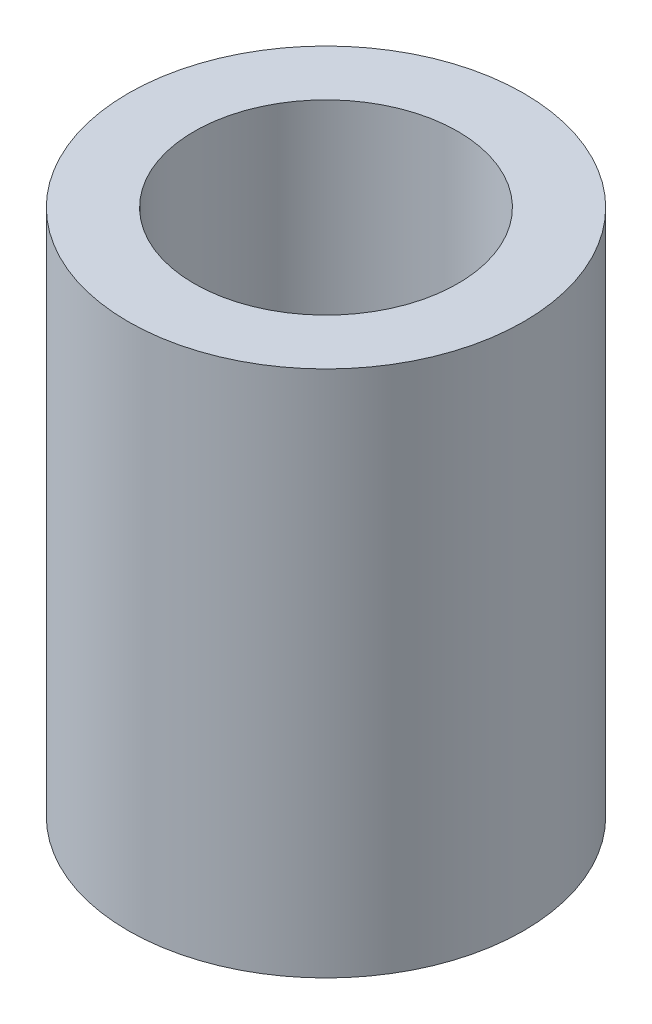
from build123d import *

# Parameters (mm, degrees)
SKETCH1_R           = 2.25
SKETCH1_R_2         = 1.5
BOSS_EXTRUDE1_DEPTH = 6


with BuildPart() as part:
    # Sketch1 → Boss-Extrude1 (new body)
    with BuildSketch(Plane(origin=(0, 0, 0), x_dir=(1, 0, 0), z_dir=(0, 1, 0))):
        with Locations(Location((0, 0, 0), (0, 0, 270))):
            Circle(SKETCH1_R)
        with Locations(Location((0, 0, 0), (0, 0, 270))):
            Circle(SKETCH1_R_2, mode=Mode.SUBTRACT)
    extrude(amount=BOSS_EXTRUDE1_DEPTH)


solid = part.part
